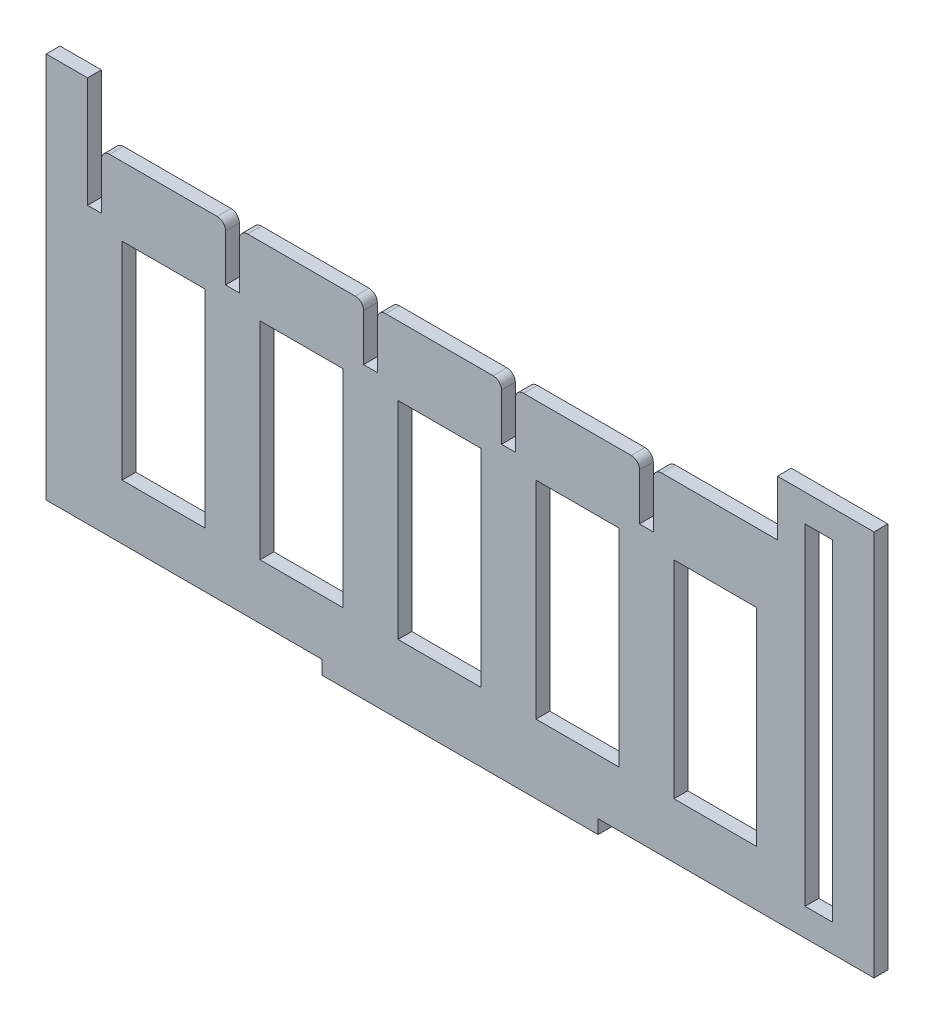
from build123d import *

# Parameters (mm, degrees)
SKIZZE1_W                       = 100
SKIZZE1_H                       = 5
SKIZZE1_W_2                     = 300
SKIZZE1_H_2                     = 140
AUFSATZ_LINEAR_AUSTRAGEN1_DEPTH = 5
SCHNITT_LINEAR_AUSTRAGEN1_DEPTH = 168.779617356
VERRUNDUNG1_R                   = 3
SKIZZE3_W                       = 30
SKIZZE3_H                       = 75
SKIZZE3_W_2                     = 10
SKIZZE3_H_2                     = 120
SCHNITT_LINEAR_AUSTRAGEN2_DEPTH = 168.779617356


with BuildPart() as part:
    # Skizze1 → Aufsatz-Linear austragen1 (new body)
    with BuildSketch(Plane.XY):
        with Locations((0, -72.5)):
            Rectangle(SKIZZE1_W, SKIZZE1_H)
        Rectangle(SKIZZE1_W_2, SKIZZE1_H_2)
    extrude(amount=AUFSATZ_LINEAR_AUSTRAGEN1_DEPTH)

    # Skizze2 → Schnitt-Linear austragen1 (cut, through all)
    with BuildSketch(Plane.XY.offset(5)):
        Polygon((-135, 70), (115, 70), (115, 50), (70, 50), (70, 30), (65, 30), (65, 50), (20, 50), (20, 30), (15, 30), (15, 50), (-30, 50), (-30, 30), (-35, 30), (-35, 50), (-80, 50), (-80, 30), (-85, 30), (-85, 50), (-130, 50), (-130, 30), (-135, 30), (-135, 50), align=None)
    extrude(amount=-SCHNITT_LINEAR_AUSTRAGEN1_DEPTH, mode=Mode.SUBTRACT)

    # Verrundung1
    verrundung1_edges = [part.edges().sort_by_distance(p)[0] for p in [
        (70, 50, 2.5),
        (65, 50, 2.5),
        (20, 50, 2.5),
        (15, 50, 2.5),
        (-30, 50, 2.5),
        (-35, 50, 2.5),
        (-80, 50, 2.5),
        (-85, 50, 2.5),
        (-130, 50, 2.5),
    ]]
    fillet(verrundung1_edges, radius=VERRUNDUNG1_R)

    # Skizze3 → Schnitt-Linear austragen2 (cut, through all)
    with BuildSketch(Plane.XY.offset(5)):
        with Locations((-107.5, -12.5)):
            Rectangle(SKIZZE3_W, SKIZZE3_H)
        with Locations((-57.5, -12.5)):
            Rectangle(SKIZZE3_W, SKIZZE3_H)
        with Locations((-7.5, -12.5)):
            Rectangle(SKIZZE3_W, SKIZZE3_H)
        with Locations((42.5, -12.5)):
            Rectangle(SKIZZE3_W, SKIZZE3_H)
        with Locations((92.5, -12.5)):
            Rectangle(SKIZZE3_W, SKIZZE3_H)
        with Locations((130, 0)):
            Rectangle(SKIZZE3_W_2, SKIZZE3_H_2)
    extrude(amount=-SCHNITT_LINEAR_AUSTRAGEN2_DEPTH, mode=Mode.SUBTRACT)


solid = part.part
